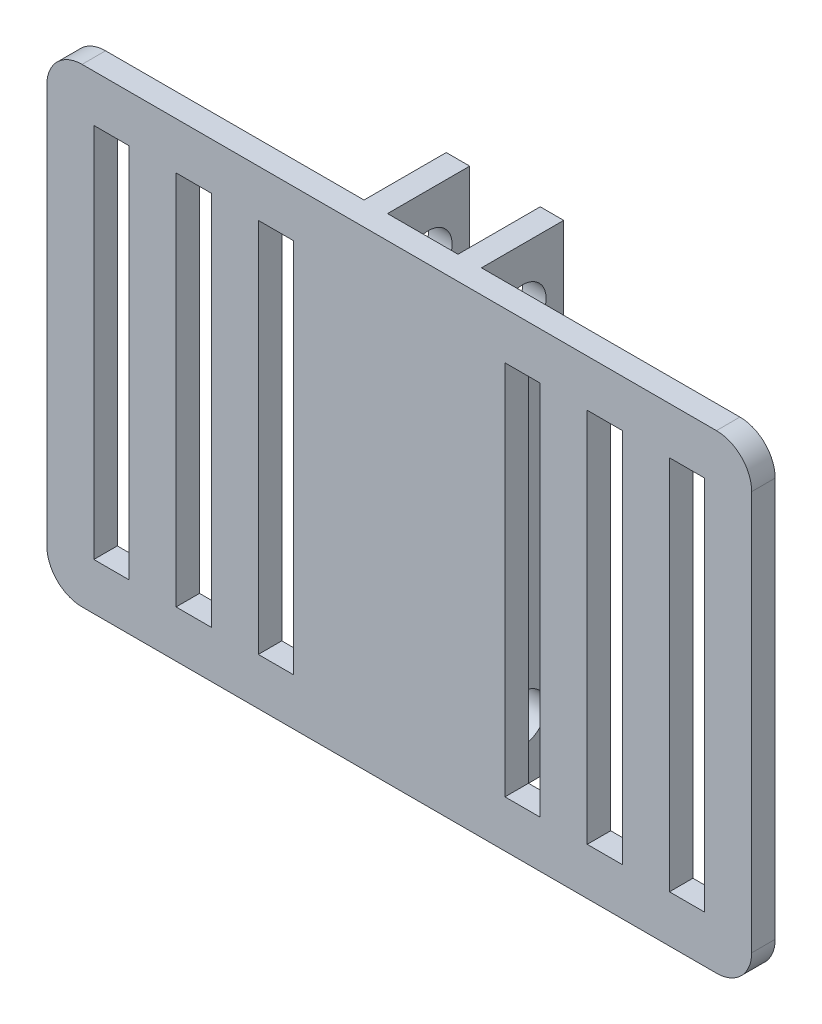
from build123d import *

# Parameters (mm, degrees)
ESQUISSE1_W             = 60
ESQUISSE1_H             = 40
BOSS_EXTRU_1_DEPTH      = 9
ESQUISSE2_W             = 25
ESQUISSE2_H             = 40
ESQUISSE2_W_2           = 6
ENL_V_MAT_EXTRU_1_DEPTH = 7
ESQUISSE3_R             = 2
ENL_V_MAT_EXTRU_2_DEPTH = 54.907327888
ESQUISSE4_W             = 3
ESQUISSE4_H             = 32
ENL_V_MAT_EXTRU_3_DEPTH = 73.449982747
CONG_1_R                = 3


with BuildPart() as part:
    # Esquisse1 → Boss.-Extru.1 (new body)
    with BuildSketch(Plane.XY):
        with Locations((30, 20)):
            Rectangle(ESQUISSE1_W, ESQUISSE1_H)
    extrude(amount=BOSS_EXTRU_1_DEPTH)

    # Esquisse2 → Enlèv. mat.-Extru.1 (cut)
    with BuildSketch(Plane(origin=(0, 0, 0), x_dir=(-1, 0, 0), z_dir=(0, 0, -1))):
        with Locations((-12.5, 20)):
            Rectangle(ESQUISSE2_W, ESQUISSE2_H)
        with Locations((-47.5, 20)):
            Rectangle(ESQUISSE2_W, ESQUISSE2_H)
        with Locations((-30, 20)):
            Rectangle(ESQUISSE2_W_2, ESQUISSE2_H)
    extrude(amount=-ENL_V_MAT_EXTRU_1_DEPTH, mode=Mode.SUBTRACT)

    # Esquisse3 → Enlèv. mat.-Extru.2 (cut, through all)
    with BuildSketch(Plane(origin=(35, 0, 0), x_dir=(0, 0, -1), z_dir=(1, 0, 0))):
        with Locations((-3.5, 5)):
            Circle(ESQUISSE3_R)
        with Locations((-3.5, 35)):
            Circle(ESQUISSE3_R)
    extrude(amount=-ENL_V_MAT_EXTRU_2_DEPTH, mode=Mode.SUBTRACT)

    # Esquisse4 → Enlèv. mat.-Extru.3 (cut, through all)
    with BuildSketch(Plane(origin=(0, 0, 7), x_dir=(-1, 0, 0), z_dir=(0, 0, -1))):
        with Locations((-47.5, 20)):
            Rectangle(ESQUISSE4_W, ESQUISSE4_H)
        with Locations((-54.5, 20)):
            Rectangle(ESQUISSE4_W, ESQUISSE4_H)
        with Locations((-40.5, 20)):
            Rectangle(ESQUISSE4_W, ESQUISSE4_H)
        with Locations((-12.5, 20)):
            Rectangle(ESQUISSE4_W, ESQUISSE4_H)
        with Locations((-5.5, 20)):
            Rectangle(ESQUISSE4_W, ESQUISSE4_H)
        with Locations((-19.5, 20)):
            Rectangle(ESQUISSE4_W, ESQUISSE4_H)
    extrude(amount=-ENL_V_MAT_EXTRU_3_DEPTH, mode=Mode.SUBTRACT)

    # Congé1
    cong_1_edges = [part.edges().sort_by_distance(p)[0] for p in [
        (0, 40, 8),
        (60, 40, 8),
        (60, 0, 8),
        (0, 0, 8),
    ]]
    fillet(cong_1_edges, radius=CONG_1_R)


solid = part.part
